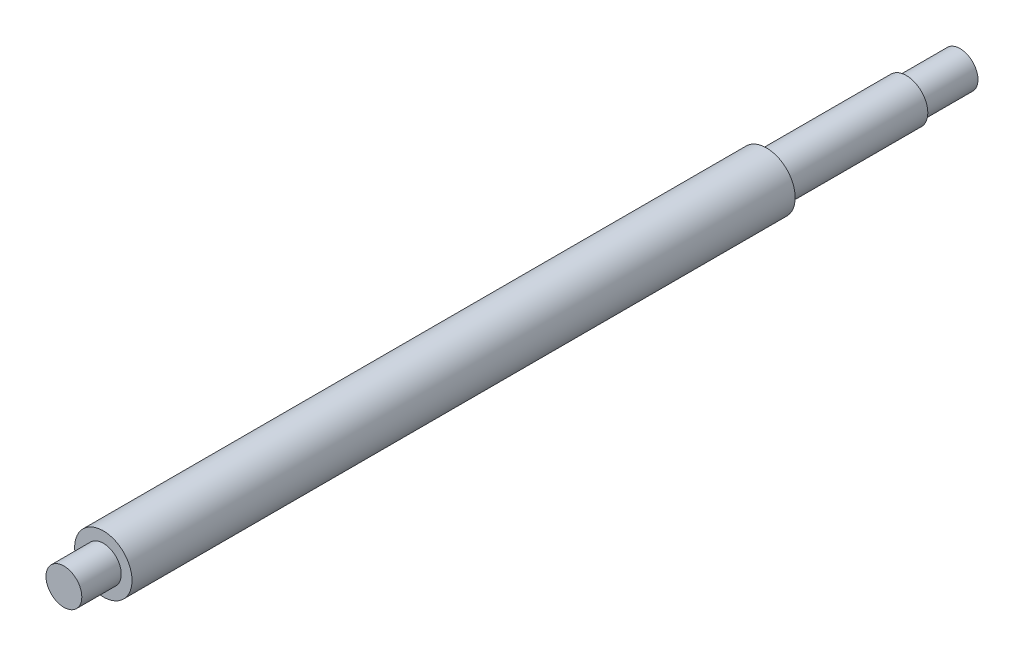
from build123d import *

# Parameters (mm, degrees)
ESQUISSE1_R        = 5
BOSS_EXTRU_1_DEPTH = 15
ESQUISSE2_R        = 6
BOSS_EXTRU_2_DEPTH = 39
ESQUISSE3_R        = 8
BOSS_EXTRU_3_DEPTH = 185
ESQUISSE4_R        = 5
BOSS_EXTRU_4_DEPTH = 11


with BuildPart() as part:
    # Esquisse1 → Boss.-Extru.1 (new body)
    with BuildSketch(Plane.XY):
        Circle(ESQUISSE1_R)
    extrude(amount=BOSS_EXTRU_1_DEPTH)

    # Esquisse2 → Boss.-Extru.2 (add)
    with BuildSketch(Plane.XY.offset(15)):
        Circle(ESQUISSE2_R)
    extrude(amount=BOSS_EXTRU_2_DEPTH)

    # Esquisse3 → Boss.-Extru.3 (add)
    with BuildSketch(Plane.XY.offset(54)):
        Circle(ESQUISSE3_R)
    extrude(amount=BOSS_EXTRU_3_DEPTH)

    # Esquisse4 → Boss.-Extru.4 (add)
    with BuildSketch(Plane.XY.offset(239)):
        Circle(ESQUISSE4_R)
    extrude(amount=BOSS_EXTRU_4_DEPTH)


solid = part.part
